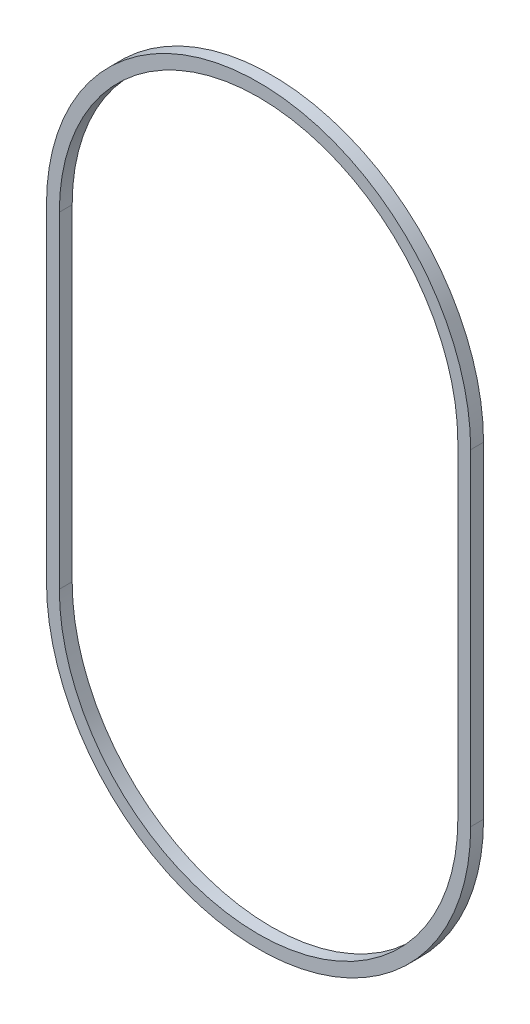
from build123d import *

# Parameters (mm, degrees)
BOSS_EXTRUDE1_DEPTH = 2.5


with BuildPart() as part:
    # Sketch1 → Boss-Extrude1 (new body)
    with BuildSketch(Plane.XY):
        with BuildLine():
            Line((-41.25, -31.75), (-41.25, 31.75))
            ThreePointArc((-41.25, 31.75), (0, 73), (41.25, 31.75))
            Line((41.25, 31.75), (41.25, -31.75))
            ThreePointArc((41.25, -31.75), (0, -73), (-41.25, -31.75))
        make_face()
        with BuildLine():
            Line((-38.75, -31.75), (-38.75, 31.75))
            ThreePointArc((-38.75, 31.75), (0, 70.5), (38.75, 31.75))
            Line((38.75, 31.75), (38.75, -31.75))
            ThreePointArc((38.75, -31.75), (0, -70.5), (-38.75, -31.75))
        make_face(mode=Mode.SUBTRACT)
    extrude(amount=BOSS_EXTRUDE1_DEPTH)


solid = part.part
